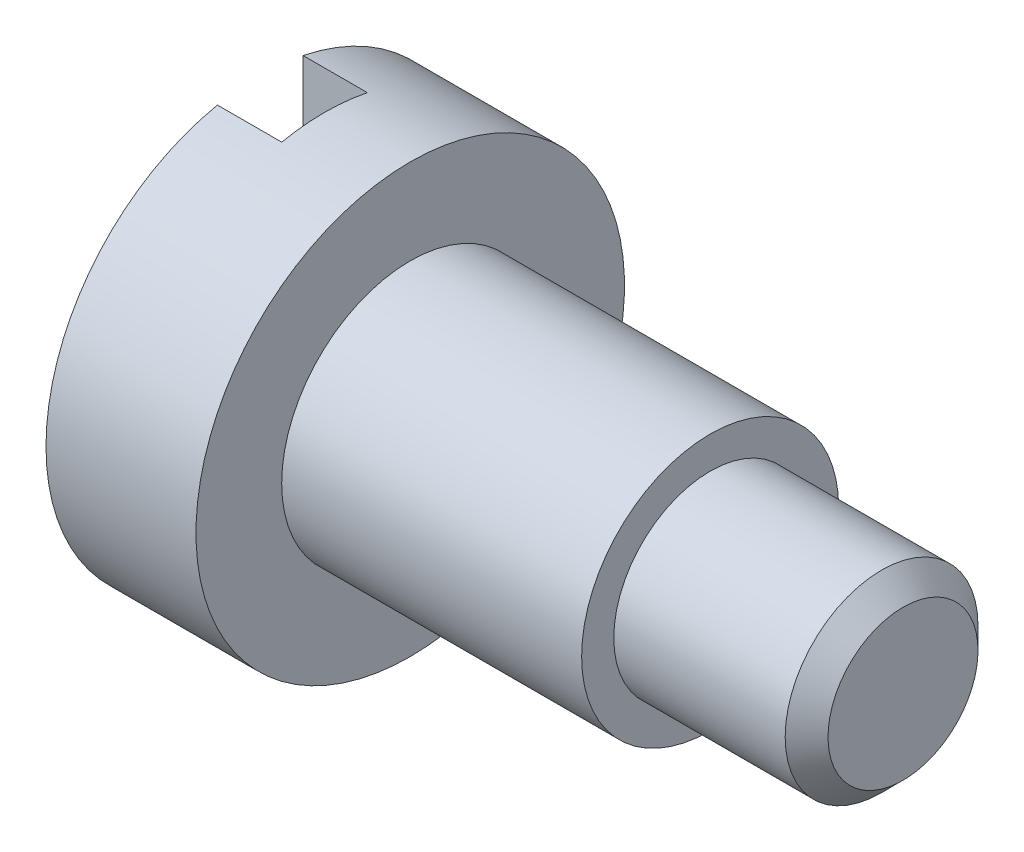
from build123d import *

# Parameters (mm, degrees)
ESQUISSE2_W             = 2
ESQUISSE2_H             = 12.833084331
ENL_V_MAT_EXTRU_1_DEPTH = 1.5


with BuildPart() as part:
    # Esquisse1 → Révolution1 (revolve)
    with BuildSketch(Plane.XY):
        Polygon((0, 0), (0, 5), (3.5, 5), (3.5, 3), (10.5, 3), (10.5, 2.25), (14.5, 2.25), (15, 1.75), (15, 0), align=None)
    revolve(axis=Axis((15, 0, 0), (-1, 0, 0)))

    # Esquisse2 → Enlèv. mat.-Extru.1 (cut)
    with BuildSketch(Plane.ZY):
        with Locations((0, -0.051559527)):
            Rectangle(ESQUISSE2_W, ESQUISSE2_H)
    extrude(amount=-ENL_V_MAT_EXTRU_1_DEPTH, mode=Mode.SUBTRACT)


solid = part.part
